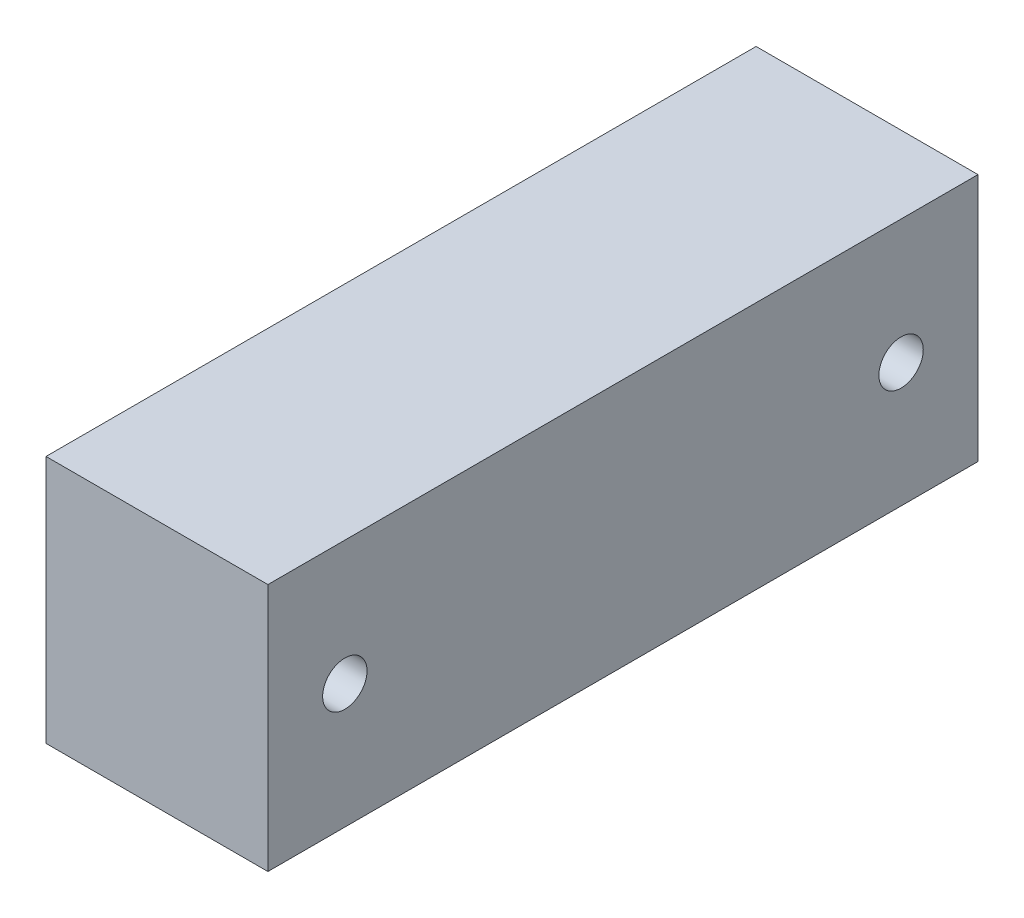
from build123d import *

# Parameters (mm, degrees)
CROQUIS1_W              = 48
CROQUIS1_H              = 16.8
CROQUIS1_R              = 1.5
SALIENTE_EXTRUIR1_DEPTH = 15


with BuildPart() as part:
    # Croquis1 → Saliente-Extruir1 (new body)
    with BuildSketch(Plane(origin=(0, 0, 0), x_dir=(0, 0, -1), z_dir=(1, 0, 0))):
        Rectangle(CROQUIS1_W, CROQUIS1_H)
        with Locations((-18.8, 0)):
            Circle(CROQUIS1_R, mode=Mode.SUBTRACT)
        with Locations((18.8, 0)):
            Circle(CROQUIS1_R, mode=Mode.SUBTRACT)
    extrude(amount=SALIENTE_EXTRUIR1_DEPTH)


solid = part.part
